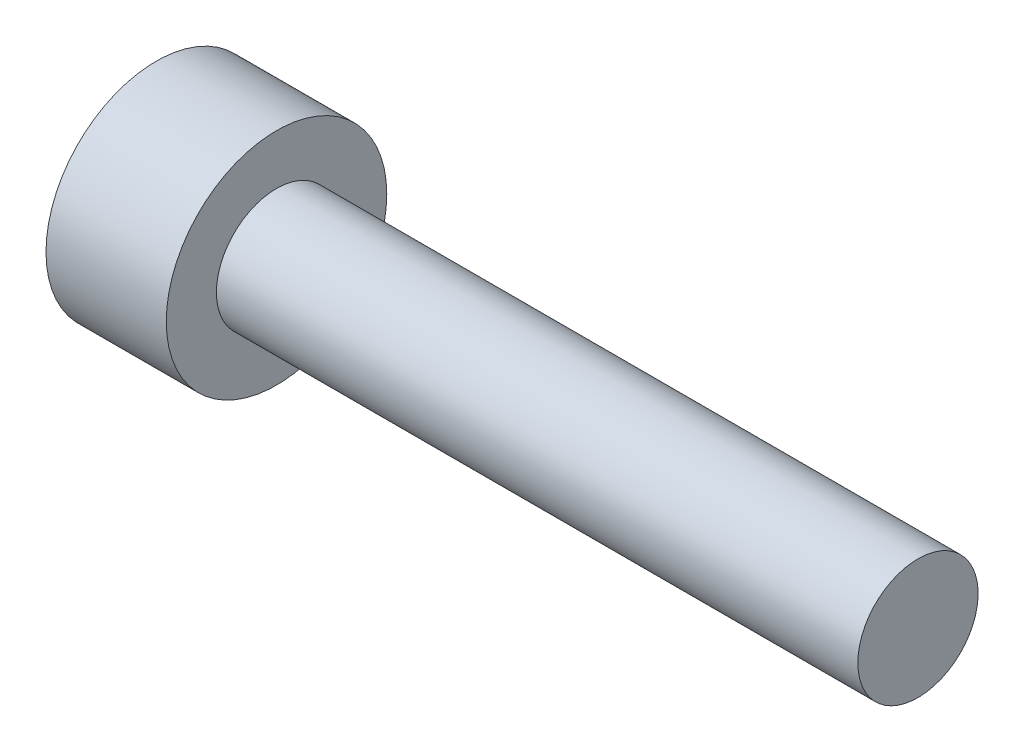
from build123d import *

# Parameters (mm, degrees)
SOCKET_DEPTH = 1.5


with BuildPart() as part:
    # Screw Sketch → Screw (revolve)
    with BuildSketch(Plane.XY):
        Polygon((-3, 0), (-3, 2.75), (0, 2.75), (0, 1.5), (16, 1.5), (16, 0), align=None)
    revolve(axis=Axis((-1000, 0, 0), (1, 0, 0)))

    # Socket Sketch → Socket (cut)
    with BuildSketch(Plane(origin=(-3, 0, 0), x_dir=(0, 0, -1), z_dir=(1, 0, 0))):
        Polygon((1.443375673, 0), (0.721687836, 1.25), (-0.721687836, 1.25), (-1.443375673, 0), (-0.721687836, -1.25), (0.721687836, -1.25), align=None)
    extrude(amount=SOCKET_DEPTH, mode=Mode.SUBTRACT)


solid = part.part
